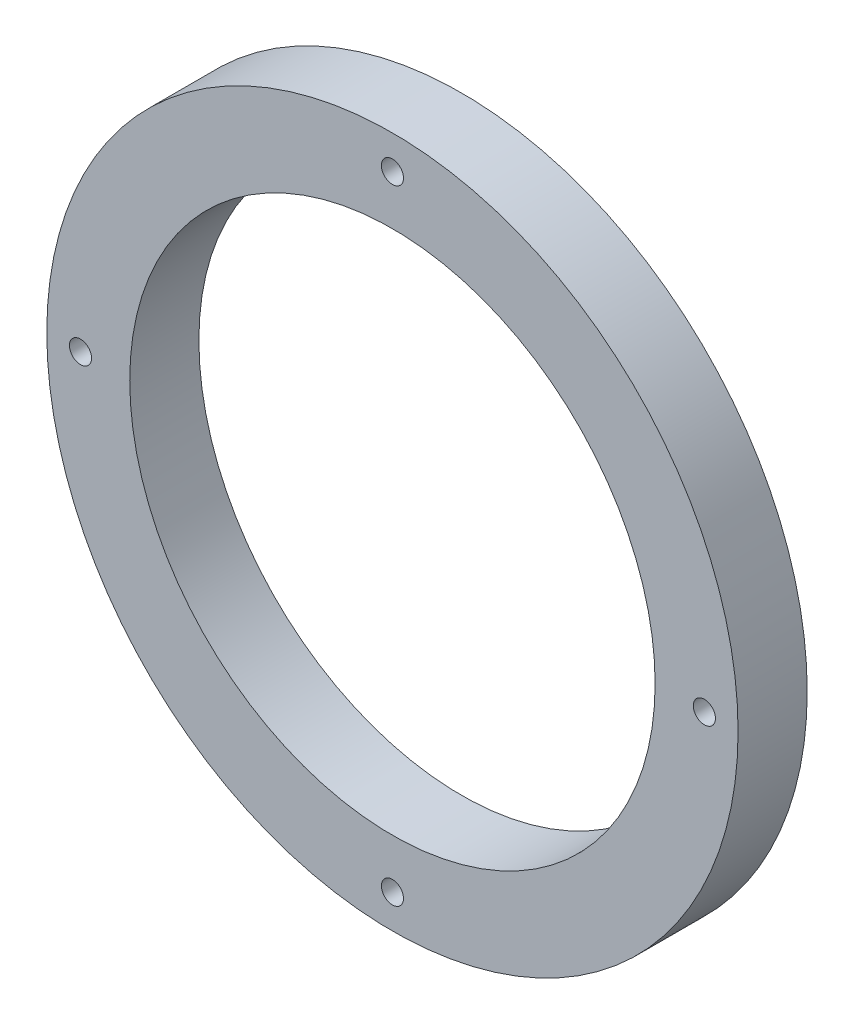
from build123d import *

# Parameters (mm, degrees)
SKETCH1_R           = 50
SKETCH1_R_2         = 38
SKETCH1_R_3         = 1.6
BOSS_EXTRUDE1_DEPTH = 10


with BuildPart() as part:
    # Sketch1 → Boss-Extrude1 (new body)
    with BuildSketch(Plane.XY):
        Circle(SKETCH1_R)
        Circle(SKETCH1_R_2, mode=Mode.SUBTRACT)
        with Locations((0, 45.125)):
            Circle(SKETCH1_R_3, mode=Mode.SUBTRACT)
        with Locations((45.125, 0)):
            Circle(SKETCH1_R_3, mode=Mode.SUBTRACT)
        with Locations((0, -45.125)):
            Circle(SKETCH1_R_3, mode=Mode.SUBTRACT)
        with Locations((-45.125, 0)):
            Circle(SKETCH1_R_3, mode=Mode.SUBTRACT)
    extrude(amount=BOSS_EXTRUDE1_DEPTH)


solid = part.part
